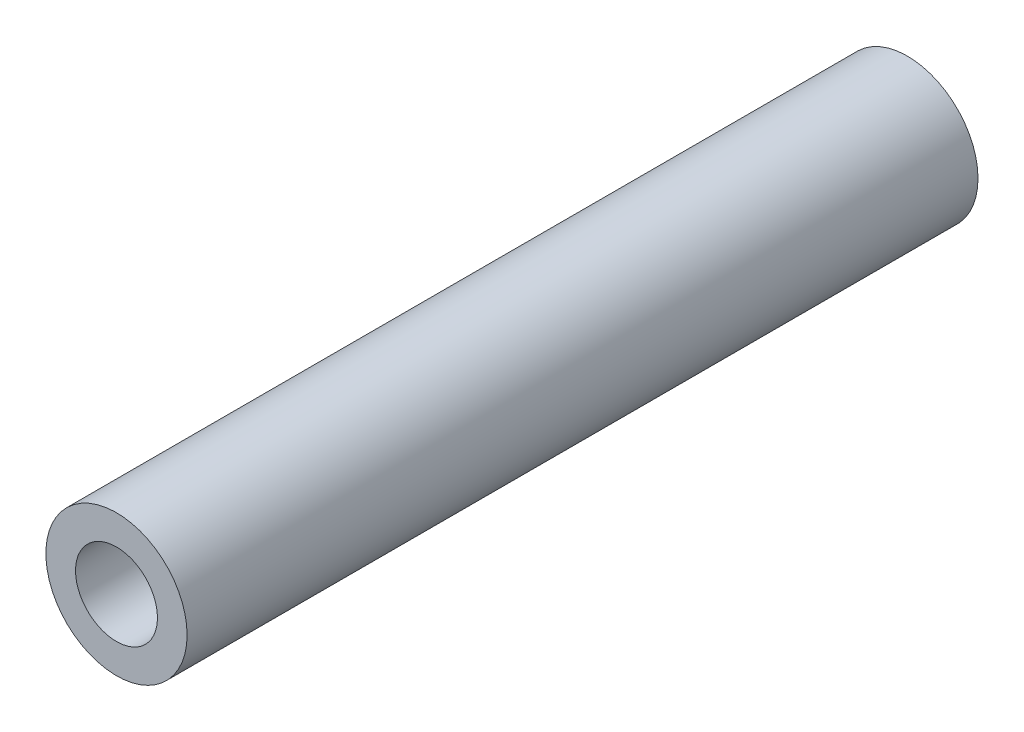
from build123d import *

# Parameters (mm, degrees)
ESBO_O1_R                = 5
RESSALTO_EXTRUS_O1_DEPTH = 56
FURO_COM_FOLGA_DE_M51_D  = 5.8


with BuildPart() as part:
    # Esboço1 → Ressalto-extrusão1 (new body)
    with BuildSketch(Plane.XY):
        Circle(ESBO_O1_R)
    extrude(amount=RESSALTO_EXTRUS_O1_DEPTH)

    # Furo com folga de M51 (through all)
    with Locations(Plane(origin=(0, 0, 0), x_dir=(-1, 0, 0), z_dir=(0, 0, -1))):
        with Locations((0, 0)):
            Hole(FURO_COM_FOLGA_DE_M51_D / 2)


solid = part.part
